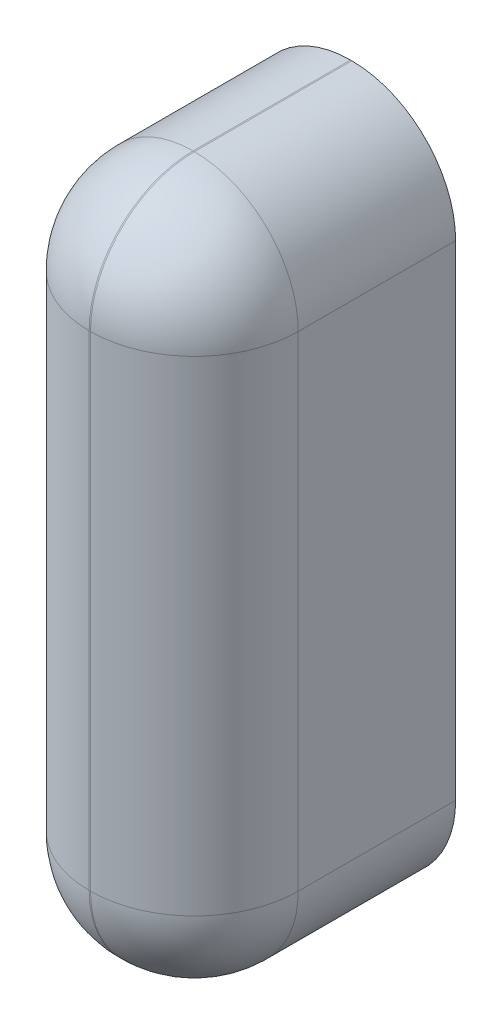
from build123d import *

# Parameters (mm, degrees)
EXTRUDE_1_DEPTH = 4
FILLET_1_R      = 1.59


with BuildPart() as part:
    # Эскиз1 → Бобышка-Вытянуть1 (new body)
    with BuildSketch(Plane.XY):
        with BuildLine():
            Line((-0.01, -5.3), (0.01, -5.3))
            ThreePointArc((0.01, -5.3), (1.134299782, -4.834299782), (1.6, -3.71))
            Line((1.6, -3.71), (1.6, 3.71))
            ThreePointArc((1.6, 3.71), (1.134299782, 4.834299782), (0.01, 5.3))
            Line((0.01, 5.3), (-0.01, 5.3))
            ThreePointArc((-0.01, 5.3), (-1.134299782, 4.834299782), (-1.6, 3.71))
            Line((-1.6, 3.71), (-1.6, -3.71))
            ThreePointArc((-1.6, -3.71), (-1.134299782, -4.834299782), (-0.01, -5.3))
        make_face()
    extrude(amount=EXTRUDE_1_DEPTH)

    # Скругление1
    fillet_1_edges = [part.edges().sort_by_distance(p)[0] for p in [
        (1.134299782, 4.834299782, 4),
        (0, 5.3, 4),
        (-1.134299782, 4.834299782, 4),
        (-1.6, 0, 4),
        (-1.134299782, -4.834299782, 4),
        (0, -5.3, 4),
        (1.134299782, -4.834299782, 4),
        (1.6, 0, 4),
    ]]
    fillet(fillet_1_edges, radius=FILLET_1_R)


solid = part.part
